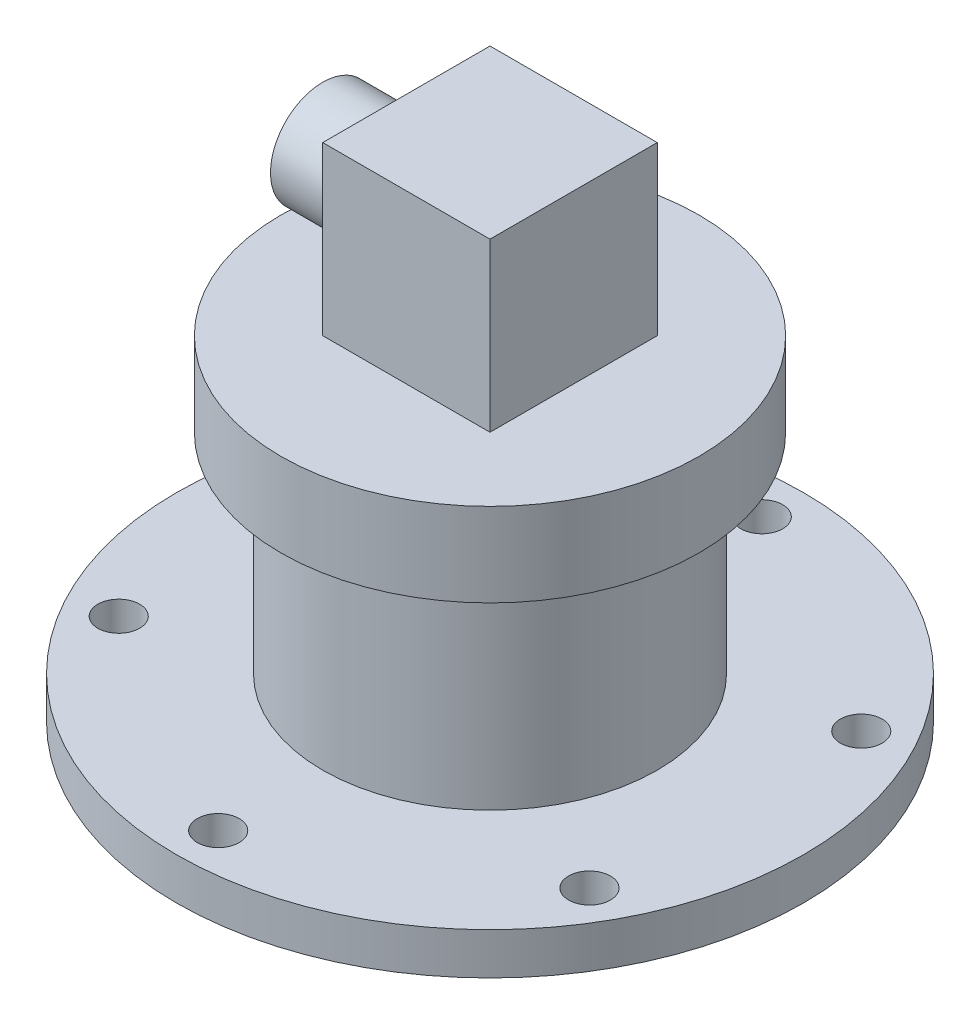
from build123d import *

# Parameters (mm, degrees)
SKETCH1_R           = 75
BOSS_EXTRUDE1_DEPTH = 10
SKETCH2_R           = 5
CUT_EXTRUDE1_DEPTH  = 10
SKETCH3_R           = 40
BOSS_EXTRUDE2_DEPTH = 50
SKETCH4_R           = 50
BOSS_EXTRUDE3_DEPTH = 20
SKETCH5_W           = 40
SKETCH5_H           = 40
BOSS_EXTRUDE4_DEPTH = 40
SKETCH6_R           = 12.5
BOSS_EXTRUDE5_DEPTH = 20
SKETCH9_R           = 7.5
CUT_EXTRUDE2_DEPTH  = 15


with BuildPart() as part:
    # Sketch1 → Boss-Extrude1 (new body)
    with BuildSketch(Plane(origin=(0, 0, 0), x_dir=(1, 0, 0), z_dir=(0, 1, 0))):
        with Locations(Location((0, 0, 0), (0, 0, 270))):
            Circle(SKETCH1_R)
    extrude(amount=BOSS_EXTRUDE1_DEPTH)

    # Sketch2 → Cut-Extrude1 (cut)
    with BuildSketch(Plane(origin=(0, 10, 0), x_dir=(1, 0, 0), z_dir=(0, 1, 0))):
        with Locations(Location((0, 65, 0), (0, 0, 270))):
            Circle(SKETCH2_R)
        with Locations(Location((56.291651246, 32.5, 0), (0, 0, 270))):
            Circle(SKETCH2_R)
        with Locations(Location((56.291651246, -32.5, 0), (0, 0, 270))):
            Circle(SKETCH2_R)
        with Locations(Location((0, -65, 0), (0, 0, 270))):
            Circle(SKETCH2_R)
        with Locations(Location((-56.291651246, -32.5, 0), (0, 0, 270))):
            Circle(SKETCH2_R)
        with Locations(Location((-56.291651246, 32.5, 0), (0, 0, 270))):
            Circle(SKETCH2_R)
    extrude(amount=-CUT_EXTRUDE1_DEPTH, mode=Mode.SUBTRACT)

    # Sketch3 → Boss-Extrude2 (add)
    with BuildSketch(Plane(origin=(0, 10, 0), x_dir=(1, 0, 0), z_dir=(0, 1, 0))):
        with Locations(Location((0, 0, 0), (0, 0, 270))):
            Circle(SKETCH3_R)
    extrude(amount=BOSS_EXTRUDE2_DEPTH)

    # Sketch4 → Boss-Extrude3 (add)
    with BuildSketch(Plane(origin=(0, 60, 0), x_dir=(1, 0, 0), z_dir=(0, 1, 0))):
        with Locations(Location((0, 0, 0), (0, 0, 270))):
            Circle(SKETCH4_R)
    extrude(amount=BOSS_EXTRUDE3_DEPTH)

    # Sketch5 → Boss-Extrude4 (add)
    with BuildSketch(Plane(origin=(0, 80, 0), x_dir=(1, 0, 0), z_dir=(0, 1, 0))):
        Rectangle(SKETCH5_W, SKETCH5_H)
    extrude(amount=BOSS_EXTRUDE4_DEPTH)

    # Sketch6 → Boss-Extrude5 (add)
    with BuildSketch(Plane.ZY.offset(20)):
        with Locations(Location((0, 100, 0), (0, 0, 180))):
            Circle(SKETCH6_R)
    extrude(amount=BOSS_EXTRUDE5_DEPTH)

    # Sketch9 → Cut-Extrude2 (cut)
    with BuildSketch(Plane.ZY.offset(40)):
        with Locations((0, 100)):
            Circle(SKETCH9_R)
    extrude(amount=-CUT_EXTRUDE2_DEPTH, mode=Mode.SUBTRACT)


solid = part.part
